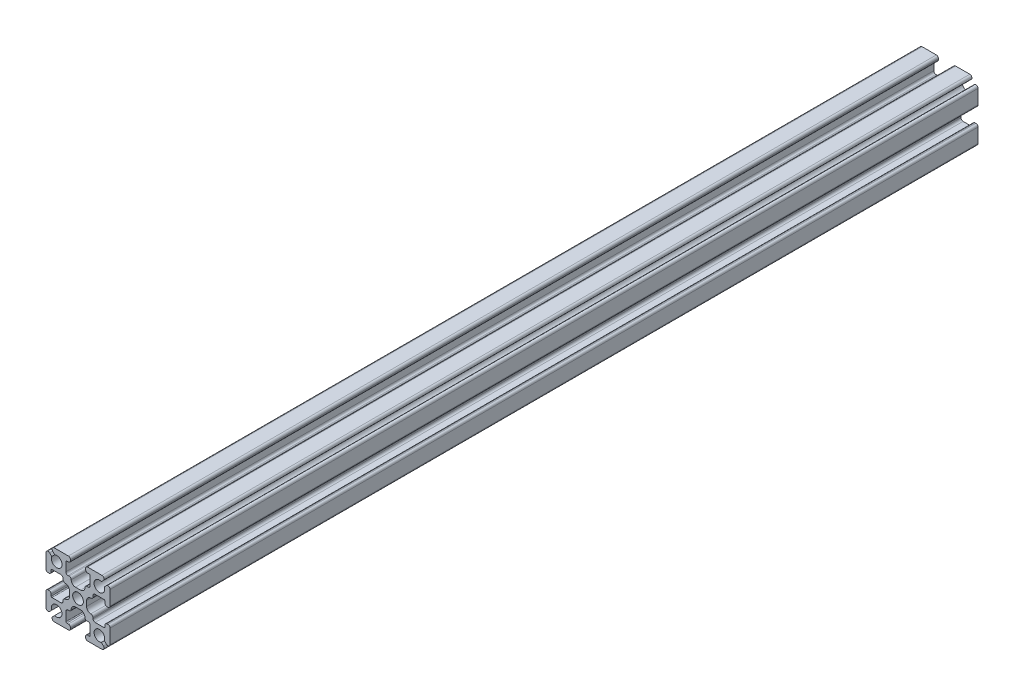
from build123d import *

# Parameters (mm, degrees)
SKETCH1_R           = 1.25
BOSS_EXTRUDE1_DEPTH = 203.2


with BuildPart() as part:
    # Sketch1 → Boss-Extrude1 (new body)
    with BuildSketch(Plane.XY):
        with BuildLine():
            Line((6.646446609, 5.939339828), (6.163645978, 5.456539197))
            ThreePointArc((6.163645978, 5.456539197), (4.116116524, 4.116116524), (5.456539197, 6.163645978))
            Line((5.456539197, 6.163645978), (5.939339828, 6.646446609))
            ThreePointArc((5.939339828, 6.646446609), (6.047726204, 7.191341716), (5.585786438, 7.5))
            Line((5.585786438, 7.5), (2.25, 7.5))
            ThreePointArc((2.25, 7.5), (1.896446609, 7.353553391), (1.75, 7))
            Line((1.75, 7), (1.75, 6.8))
            ThreePointArc((1.75, 6.8), (1.896446609, 6.446446609), (2.25, 6.3))
            Line((2.25, 6.3), (2.65, 6.3))
            ThreePointArc((2.65, 6.3), (2.791421356, 6.241421356), (2.85, 6.1))
            Line((2.85, 6.1), (2.85, 4))
            ThreePointArc((2.85, 4), (2.703553391, 3.646446609), (2.35, 3.5))
            Line((2.35, 3.5), (2.1, 3.5))
            ThreePointArc((2.1, 3.5), (1.746446609, 3.353553391), (1.6, 3))
            ThreePointArc((1.6, 3), (1.307106781, 2.292893219), (0.6, 2))
            Line((0.6, 2), (-0.6, 2))
            ThreePointArc((-0.6, 2), (-1.307106781, 2.292893219), (-1.6, 3))
            ThreePointArc((-1.6, 3), (-1.746446609, 3.353553391), (-2.1, 3.5))
            Line((-2.1, 3.5), (-2.35, 3.5))
            ThreePointArc((-2.35, 3.5), (-2.703553391, 3.646446609), (-2.85, 4))
            Line((-2.85, 4), (-2.85, 6.1))
            ThreePointArc((-2.85, 6.1), (-2.791421356, 6.241421356), (-2.65, 6.3))
            Line((-2.65, 6.3), (-2.25, 6.3))
            ThreePointArc((-2.25, 6.3), (-1.896446609, 6.446446609), (-1.75, 6.8))
            Line((-1.75, 6.8), (-1.75, 7))
            ThreePointArc((-1.75, 7), (-1.896446609, 7.353553391), (-2.25, 7.5))
            Line((-2.25, 7.5), (-5.585786438, 7.5))
            ThreePointArc((-5.585786438, 7.5), (-6.047726204, 7.191341716), (-5.939339828, 6.646446609))
            Line((-5.939339828, 6.646446609), (-5.456539197, 6.163645978))
            ThreePointArc((-5.456539197, 6.163645978), (-4.116116524, 4.116116524), (-6.163645978, 5.456539197))
            Line((-6.163645978, 5.456539197), (-6.646446609, 5.939339828))
            ThreePointArc((-6.646446609, 5.939339828), (-7.191341716, 6.047726204), (-7.5, 5.585786438))
            Line((-7.5, 5.585786438), (-7.5, 2.25))
            ThreePointArc((-7.5, 2.25), (-7.353553391, 1.896446609), (-7, 1.75))
            Line((-7, 1.75), (-6.8, 1.75))
            ThreePointArc((-6.8, 1.75), (-6.446446609, 1.896446609), (-6.3, 2.25))
            Line((-6.3, 2.25), (-6.3, 2.65))
            ThreePointArc((-6.3, 2.65), (-6.241421356, 2.791421356), (-6.1, 2.85))
            Line((-6.1, 2.85), (-4, 2.85))
            ThreePointArc((-4, 2.85), (-3.646446609, 2.703553391), (-3.5, 2.35))
            Line((-3.5, 2.35), (-3.5, 2.1))
            ThreePointArc((-3.5, 2.1), (-3.353553391, 1.746446609), (-3, 1.6))
            ThreePointArc((-3, 1.6), (-2.292893219, 1.307106781), (-2, 0.6))
            Line((-2, 0.6), (-2, -0.6))
            ThreePointArc((-2, -0.6), (-2.292893219, -1.307106781), (-3, -1.6))
            ThreePointArc((-3, -1.6), (-3.353553391, -1.746446609), (-3.5, -2.1))
            Line((-3.5, -2.1), (-3.5, -2.35))
            ThreePointArc((-3.5, -2.35), (-3.646446609, -2.703553391), (-4, -2.85))
            Line((-4, -2.85), (-6.1, -2.85))
            ThreePointArc((-6.1, -2.85), (-6.241421356, -2.791421356), (-6.3, -2.65))
            Line((-6.3, -2.65), (-6.3, -2.25))
            ThreePointArc((-6.3, -2.25), (-6.446446609, -1.896446609), (-6.8, -1.75))
            Line((-6.8, -1.75), (-7, -1.75))
            ThreePointArc((-7, -1.75), (-7.353553391, -1.896446609), (-7.5, -2.25))
            Line((-7.5, -2.25), (-7.5, -5.585786438))
            ThreePointArc((-7.5, -5.585786438), (-7.191341716, -6.047726204), (-6.646446609, -5.939339828))
            Line((-6.646446609, -5.939339828), (-6.163645978, -5.456539197))
            ThreePointArc((-6.163645978, -5.456539197), (-4.116116524, -4.116116524), (-5.456539197, -6.163645978))
            Line((-5.456539197, -6.163645978), (-5.939339828, -6.646446609))
            ThreePointArc((-5.939339828, -6.646446609), (-6.047726204, -7.191341716), (-5.585786438, -7.5))
            Line((-5.585786438, -7.5), (-2.25, -7.5))
            ThreePointArc((-2.25, -7.5), (-1.896446609, -7.353553391), (-1.75, -7))
            Line((-1.75, -7), (-1.75, -6.8))
            ThreePointArc((-1.75, -6.8), (-1.896446609, -6.446446609), (-2.25, -6.3))
            Line((-2.25, -6.3), (-2.65, -6.3))
            ThreePointArc((-2.65, -6.3), (-2.791421356, -6.241421356), (-2.85, -6.1))
            Line((-2.85, -6.1), (-2.85, -4))
            ThreePointArc((-2.85, -4), (-2.703553391, -3.646446609), (-2.35, -3.5))
            Line((-2.35, -3.5), (-2.1, -3.5))
            ThreePointArc((-2.1, -3.5), (-1.746446609, -3.353553391), (-1.6, -3))
            ThreePointArc((-1.6, -3), (-1.307106781, -2.292893219), (-0.6, -2))
            Line((-0.6, -2), (0.6, -2))
            ThreePointArc((0.6, -2), (1.307106781, -2.292893219), (1.6, -3))
            ThreePointArc((1.6, -3), (1.746446609, -3.353553391), (2.1, -3.5))
            Line((2.1, -3.5), (2.35, -3.5))
            ThreePointArc((2.35, -3.5), (2.703553391, -3.646446609), (2.85, -4))
            Line((2.85, -4), (2.85, -6.1))
            ThreePointArc((2.85, -6.1), (2.791421356, -6.241421356), (2.65, -6.3))
            Line((2.65, -6.3), (2.25, -6.3))
            ThreePointArc((2.25, -6.3), (1.896446609, -6.446446609), (1.75, -6.8))
            Line((1.75, -6.8), (1.75, -7))
            ThreePointArc((1.75, -7), (1.896446609, -7.353553391), (2.25, -7.5))
            Line((2.25, -7.5), (5.585786438, -7.5))
            ThreePointArc((5.585786438, -7.5), (6.047726204, -7.191341716), (5.939339828, -6.646446609))
            Line((5.939339828, -6.646446609), (5.456539197, -6.163645978))
            ThreePointArc((5.456539197, -6.163645978), (4.116116524, -4.116116524), (6.163645978, -5.456539197))
            Line((6.163645978, -5.456539197), (6.646446609, -5.939339828))
            ThreePointArc((6.646446609, -5.939339828), (7.191341716, -6.047726204), (7.5, -5.585786438))
            Line((7.5, -5.585786438), (7.5, -2.25))
            ThreePointArc((7.5, -2.25), (7.353553391, -1.896446609), (7, -1.75))
            Line((7, -1.75), (6.8, -1.75))
            ThreePointArc((6.8, -1.75), (6.446446609, -1.896446609), (6.3, -2.25))
            Line((6.3, -2.25), (6.3, -2.65))
            ThreePointArc((6.3, -2.65), (6.241421356, -2.791421356), (6.1, -2.85))
            Line((6.1, -2.85), (4, -2.85))
            ThreePointArc((4, -2.85), (3.646446609, -2.703553391), (3.5, -2.35))
            Line((3.5, -2.35), (3.5, -2.1))
            ThreePointArc((3.5, -2.1), (3.353553391, -1.746446609), (3, -1.6))
            ThreePointArc((3, -1.6), (2.292893219, -1.307106781), (2, -0.6))
            Line((2, -0.6), (2, 0.6))
            ThreePointArc((2, 0.6), (2.292893219, 1.307106781), (3, 1.6))
            ThreePointArc((3, 1.6), (3.353553391, 1.746446609), (3.5, 2.1))
            Line((3.5, 2.1), (3.5, 2.35))
            ThreePointArc((3.5, 2.35), (3.646446609, 2.703553391), (4, 2.85))
            Line((4, 2.85), (6.1, 2.85))
            ThreePointArc((6.1, 2.85), (6.241421356, 2.791421356), (6.3, 2.65))
            Line((6.3, 2.65), (6.3, 2.25))
            ThreePointArc((6.3, 2.25), (6.446446609, 1.896446609), (6.8, 1.75))
            Line((6.8, 1.75), (7, 1.75))
            ThreePointArc((7, 1.75), (7.353553391, 1.896446609), (7.5, 2.25))
            Line((7.5, 2.25), (7.5, 5.585786438))
            ThreePointArc((7.5, 5.585786438), (7.191341716, 6.047726204), (6.646446609, 5.939339828))
        make_face()
        with Locations(Location((0, 0, 0), (0, 0, 180))):
            Circle(SKETCH1_R, mode=Mode.SUBTRACT)
    extrude(amount=BOSS_EXTRUDE1_DEPTH)


solid = part.part
